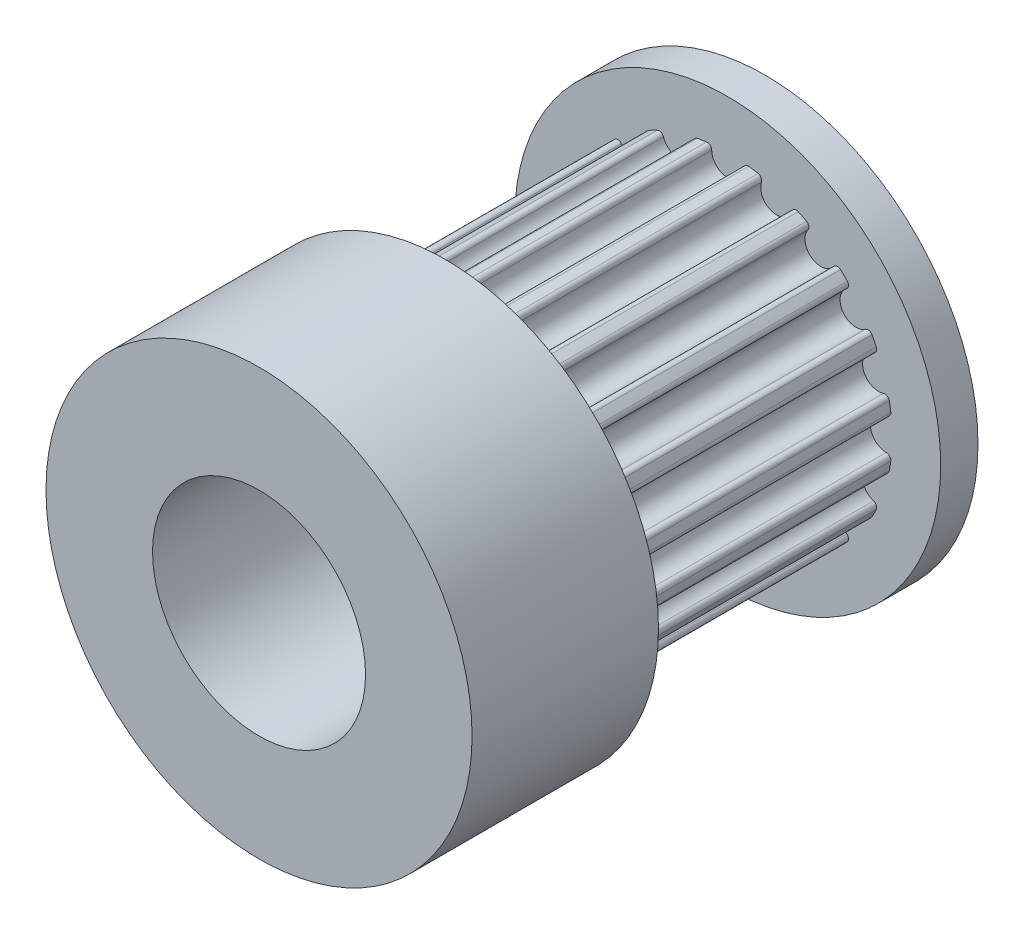
from build123d import *

# Parameters (mm, degrees)
SKETCHREVOLVEGEARBELT01_W       = 10.6
SKETCHREVOLVEGEARBELT01_H       = 6.175697631
TOOTHEXTRUDECUTGEARBELT01_DEPTH = 11.5
CIRPATTERN2_COUNT               = 20
SKETCH6_R                       = 8
BOSS_EXTRUDE1_DEPTH             = 7
BOSS_EXTRUDE2_START             = 1.4
SKETCH7_R                       = 8
BOSS_EXTRUDE2_DEPTH             = 1.4
CUT_EXTRUDE2_DEPTH              = 17.492422502
CUT_EXTRUDE2_DEPTH_BACK         = 17.492422502
SKETCH8_R                       = 4


with BuildPart() as part:
    # SketchRevolveGearBelt01 → GearBelt01 (revolve)
    with BuildSketch(Plane(origin=(0, 0, 0), x_dir=(0, 0, -1), z_dir=(1, 0, 0))):
        with Locations((5.3, 3.087848816)):
            Rectangle(SKETCHREVOLVEGEARBELT01_W, SKETCHREVOLVEGEARBELT01_H)
    revolve(axis=Axis((0, 0, 0), (0, 0, -1)))

    # SketchToothGearBelt01 → ToothExtrudeCutGearBelt01 (cut)
    with BuildSketch(Plane.XY):
        with BuildLine():
            Line((-0.791218763, 6.124803189), (0, 8.715697593))
            Line((0, 8.715697593), (0.791218763, 6.124803189))
            ThreePointArc((0.791218763, 6.124803189), (0.657587048, 6.084000517), (0.599999991, 5.956697634))
            ThreePointArc((0.599999991, 5.956697634), (0, 5.356697643), (-0.599999991, 5.956697634))
            ThreePointArc((-0.599999991, 5.956697634), (-0.657587048, 6.084000517), (-0.791218763, 6.124803189))
        make_face()
    toothextrudecutgearbelt01 = extrude(amount=-TOOTHEXTRUDECUTGEARBELT01_DEPTH, mode=Mode.SUBTRACT)

    # CirPattern2: ToothExtrudeCutGearBelt01 ×20 about axis
    cirpattern2_axis = Axis((0, 0, 0), (0, 0, 1))
    for i in range(1, CIRPATTERN2_COUNT):
        add(toothextrudecutgearbelt01.rotate(cirpattern2_axis, i * 360 / CIRPATTERN2_COUNT), mode=Mode.SUBTRACT)

    # Sketch6 → Boss-Extrude1 (add)
    with BuildSketch(Plane.XY):
        Circle(SKETCH6_R)
    extrude(amount=BOSS_EXTRUDE1_DEPTH)

    # Sketch7 → Boss-Extrude2 (add)
    with BuildSketch(Plane(origin=(0, 0, -10.6), x_dir=(-1, 0, 0), z_dir=(0, 0, -1)).offset(BOSS_EXTRUDE2_START)):
        Circle(SKETCH7_R)
    extrude(amount=-BOSS_EXTRUDE2_DEPTH)

    # Sketch8 → Cut-Extrude2 (cut, two sides: drawn at the far end of the back side and taken through both)
    with BuildSketch(Plane.XY.offset(-CUT_EXTRUDE2_DEPTH_BACK)):
        Circle(SKETCH8_R)
    extrude(amount=CUT_EXTRUDE2_DEPTH + CUT_EXTRUDE2_DEPTH_BACK, mode=Mode.SUBTRACT)


solid = part.part
